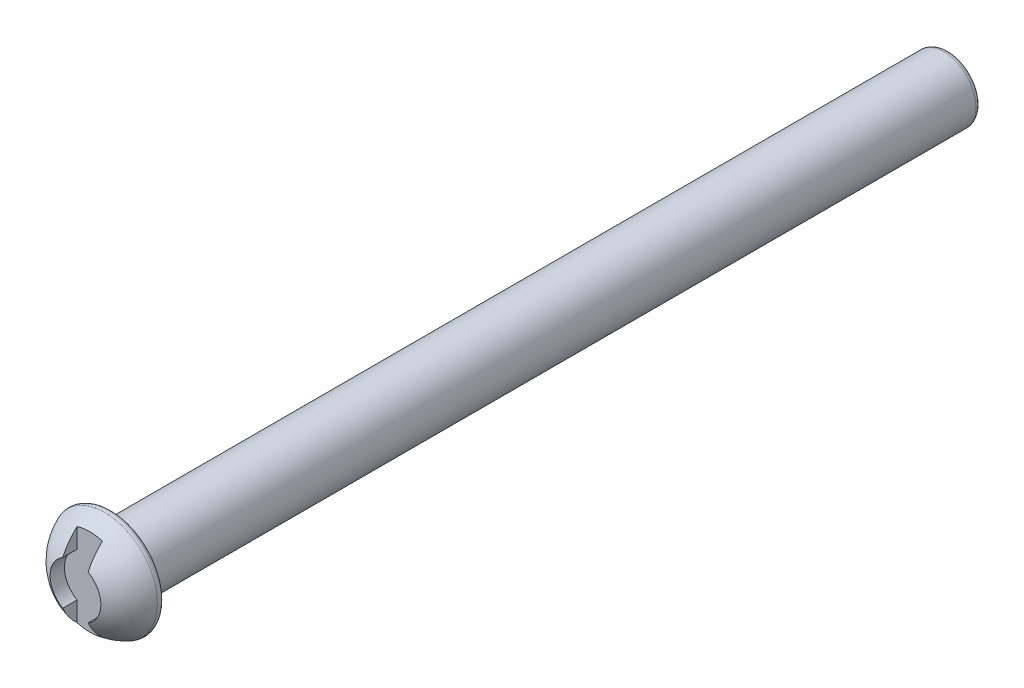
from build123d import *

# Parameters (mm, degrees)
CUT_EXTRUDE1_DEPTH = 0.6
FILLET1_R          = 0.15


with BuildPart() as part:
    # Sketch1 → Revolve1 (revolve)
    with BuildSketch(Plane(origin=(0, 0, 0), x_dir=(0, 0, -1), z_dir=(1, 0, 0))):
        with BuildLine():
            Line((0, 0), (26, 0))
            Line((26, 0), (26, 0.95))
            Line((26, 0.95), (1.25, 0.95))
            Line((1.25, 0.95), (1.25, 1.625))
            ThreePointArc((1.25, 1.625), (0.348650918, 1.025076217), (0, 0))
        make_face()
    revolve(axis=Axis((0, 0, 0), (0, 0, -1)))

    # Sketch2 → Cut-Extrude1 (cut)
    with BuildSketch(Plane.XY):
        with BuildLine():
            Line((0.375, -0.649519053), (0.375, -1.910304893))
            Line((0.375, -1.910304893), (-0.375, -1.910304893))
            Line((-0.375, -1.910304893), (-0.375, -0.649519053))
            ThreePointArc((-0.375, -0.649519053), (-0.75, 0), (-0.375, 0.649519053))
            Line((-0.375, 0.649519053), (-0.375, 1.910304893))
            Line((-0.375, 1.910304893), (0.375, 1.910304893))
            Line((0.375, 1.910304893), (0.375, 0.649519053))
            ThreePointArc((0.375, 0.649519053), (0.75, 0), (0.375, -0.649519053))
        make_face()
    extrude(amount=-CUT_EXTRUDE1_DEPTH, mode=Mode.SUBTRACT)

    # Fillet1
    fillet1_edges = [part.edges().sort_by_distance(p)[0] for p in [
        (0, -1.625, -1.25),
        (0, -0.95, -26),
    ]]
    fillet(fillet1_edges, radius=FILLET1_R)


solid = part.part
